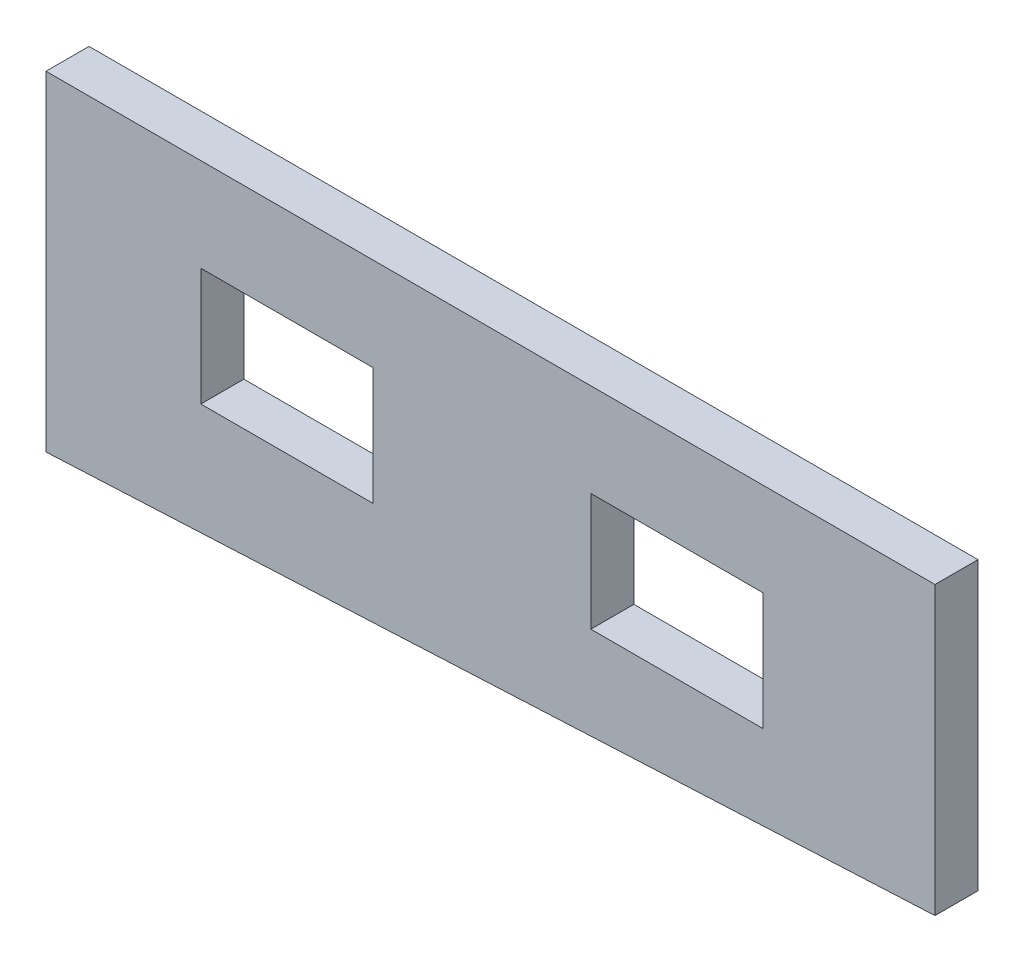
from build123d import *

# Parameters (mm, degrees)
BOSS_EXTRU_1_DEPTH      = 300
ESQUISSE2_W             = 1200
ESQUISSE2_H             = 820
ENL_V_MAT_EXTRU_1_DEPTH = 6620.667665374


with BuildPart() as part:
    # Esquisse1 → Boss.-Extru.1 (new body)
    with BuildSketch(Plane.XY):
        Polygon((0, 0), (0, 2300), (6200, 2300), (6200, 300), align=None)
    extrude(amount=BOSS_EXTRU_1_DEPTH)

    # Esquisse2 → Enlèv. mat.-Extru.1 (cut, through all)
    with BuildSketch(Plane.XY.offset(300)):
        with Locations((1680, 1240)):
            Rectangle(ESQUISSE2_W, ESQUISSE2_H)
        with Locations((4400, 1240)):
            Rectangle(ESQUISSE2_W, ESQUISSE2_H)
    extrude(amount=-ENL_V_MAT_EXTRU_1_DEPTH, mode=Mode.SUBTRACT)


solid = part.part
